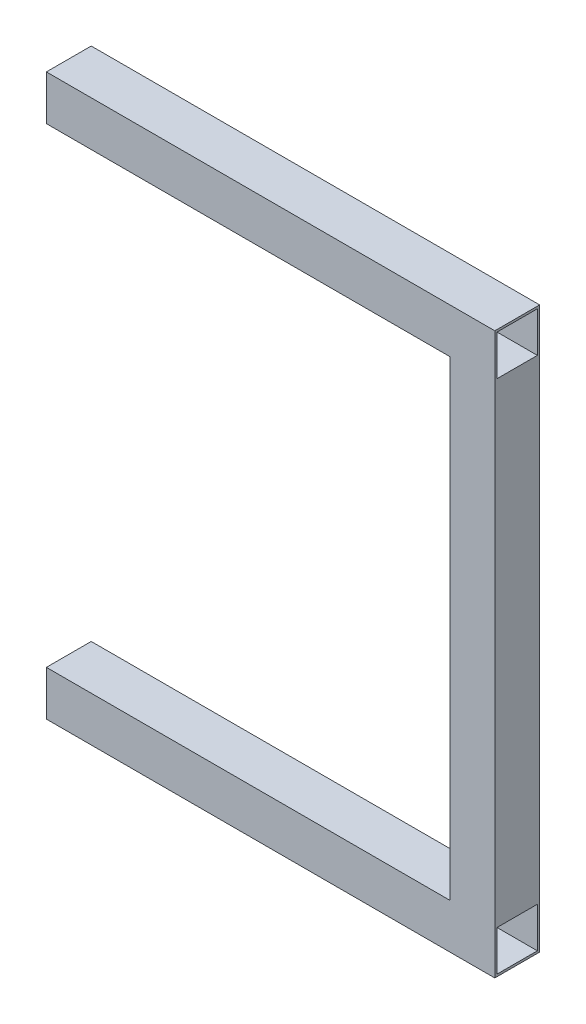
from build123d import *

# Parameters (mm, degrees)
BOSS_EXTRUDE1_DEPTH = 40
SKETCH3_W           = 36
SKETCH3_H           = 36
CUT_EXTRUDE1_DEPTH  = 448
SKETCH4_W           = 36
SKETCH4_H           = 36
CUT_EXTRUDE2_DEPTH  = 448


with BuildPart() as part:
    # Sketch2 → Boss-Extrude1 (new body)
    with BuildSketch(Plane.XY):
        Polygon((0, 0), (0, 40), (360, 40), (360, 460), (0, 460), (0, 500), (400, 500), (400, 0), align=None)
    extrude(amount=BOSS_EXTRUDE1_DEPTH)

    # Sketch3 → Cut-Extrude1 (cut)
    with BuildSketch(Plane.ZY):
        with Locations((20, 480)):
            Rectangle(SKETCH3_W, SKETCH3_H)
    extrude(amount=-CUT_EXTRUDE1_DEPTH, mode=Mode.SUBTRACT)

    # Sketch4 → Cut-Extrude2 (cut)
    with BuildSketch(Plane.ZY):
        with Locations((20, 20)):
            Rectangle(SKETCH4_W, SKETCH4_H)
    extrude(amount=-CUT_EXTRUDE2_DEPTH, mode=Mode.SUBTRACT)


solid = part.part
